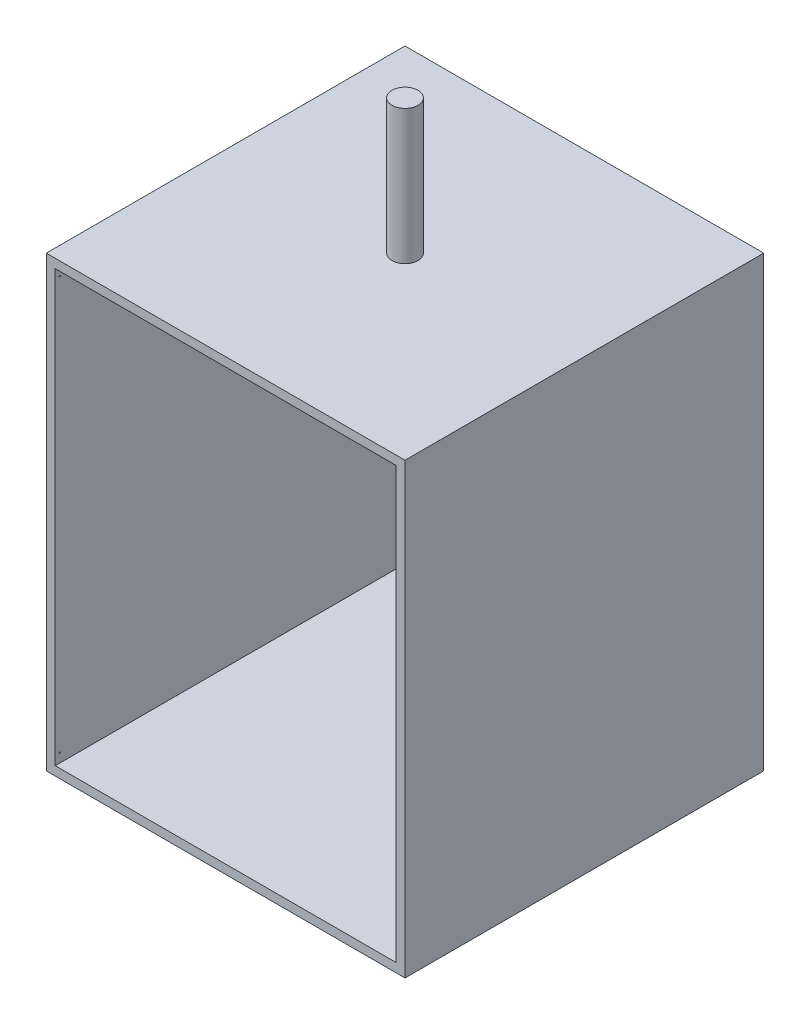
from build123d import *

# Parameters (mm, degrees)
CROQUIS2_W              = 400
CROQUIS2_H              = 500
SALIENTE_EXTRUIR1_DEPTH = 400
CROQUIS3_W              = 380
CROQUIS3_H              = 480
CORTAR_EXTRUIR1_DEPTH   = 395
CROQUIS4_R              = 25.5
SALIENTE_EXTRUIR4_DEPTH = 40
CROQUIS5_R              = 25
CORTAR_EXTRUIR2_DEPTH   = 30
CROQUIS6_R              = 14.5
SALIENTE_EXTRUIR5_DEPTH = 150
CROQUIS9_R              = 0.75
CORTAR_EXTRUIR4_DEPTH   = 1.5
CORTAR_EXTRUIR5_START   = -1.5
CROQUIS10_R             = 0.75
CORTAR_EXTRUIR5_DEPTH   = 1.5
CROQUIS12_R             = 0.75
CORTAR_EXTRUIR6_DEPTH   = 1.5
CORTAR_EXTRUIR7_START   = -1.5
CROQUIS13_R             = 0.75
CORTAR_EXTRUIR7_DEPTH   = 1.5


with BuildPart() as part:
    # Croquis2 → Saliente-Extruir1 (new body)
    with BuildSketch(Plane.XY):
        Rectangle(CROQUIS2_W, CROQUIS2_H)
    extrude(amount=-SALIENTE_EXTRUIR1_DEPTH)

    # Croquis3 → Cortar-Extruir1 (cut)
    with BuildSketch(Plane.XY):
        Rectangle(CROQUIS3_W, CROQUIS3_H)
    extrude(amount=-CORTAR_EXTRUIR1_DEPTH, mode=Mode.SUBTRACT)

    # Croquis4 → Saliente-Extruir4 (add)
    with BuildSketch(Plane(origin=(0, 0, -400), x_dir=(-1, 0, 0), z_dir=(0, 0, -1))):
        Circle(CROQUIS4_R)
    extrude(amount=SALIENTE_EXTRUIR4_DEPTH)

    # Croquis5 → Cortar-Extruir2 (cut)
    with BuildSketch(Plane(origin=(0, 0, -440), x_dir=(-1, 0, 0), z_dir=(0, 0, -1))):
        Circle(CROQUIS5_R)
    extrude(amount=-CORTAR_EXTRUIR2_DEPTH, mode=Mode.SUBTRACT)

    # Croquis6 → Saliente-Extruir5 (add)
    with BuildSketch(Plane(origin=(0, 250, 0), x_dir=(1, 0, 0), z_dir=(0, 1, 0))):
        with Locations(Location((0, 200, 0), (0, 0, 270))):
            Circle(CROQUIS6_R)
    extrude(amount=SALIENTE_EXTRUIR5_DEPTH)

    # Croquis9 → Cortar-Extruir4 (cut)
    with BuildSketch(Plane.ZY.offset(-190)):
        with Locations((-5, 230)):
            Circle(CROQUIS9_R)
    extrude(amount=-CORTAR_EXTRUIR4_DEPTH, mode=Mode.SUBTRACT)

    # Croquis10 → Cortar-Extruir5 (cut)
    with BuildSketch(Plane(origin=(-190, 0, 0), x_dir=(0, 0, -1), z_dir=(1, 0, 0)).offset(CORTAR_EXTRUIR5_START)):
        with Locations(Location((5, 230, 0), (0, 0, 180))):
            Circle(CROQUIS10_R)
    extrude(amount=CORTAR_EXTRUIR5_DEPTH, mode=Mode.SUBTRACT)

    # Croquis12 → Cortar-Extruir6 (cut)
    with BuildSketch(Plane(origin=(-190, 0, 0), x_dir=(0, 0, -1), z_dir=(1, 0, 0))):
        with Locations((5, -230)):
            Circle(CROQUIS12_R)
    extrude(amount=-CORTAR_EXTRUIR6_DEPTH, mode=Mode.SUBTRACT)

    # Croquis13 → Cortar-Extruir7 (cut)
    with BuildSketch(Plane.ZY.offset(-190).offset(CORTAR_EXTRUIR7_START)):
        with Locations(Location((-5, -230, 0), (0, 0, 180))):
            Circle(CROQUIS13_R)
    extrude(amount=CORTAR_EXTRUIR7_DEPTH, mode=Mode.SUBTRACT)


solid = part.part
